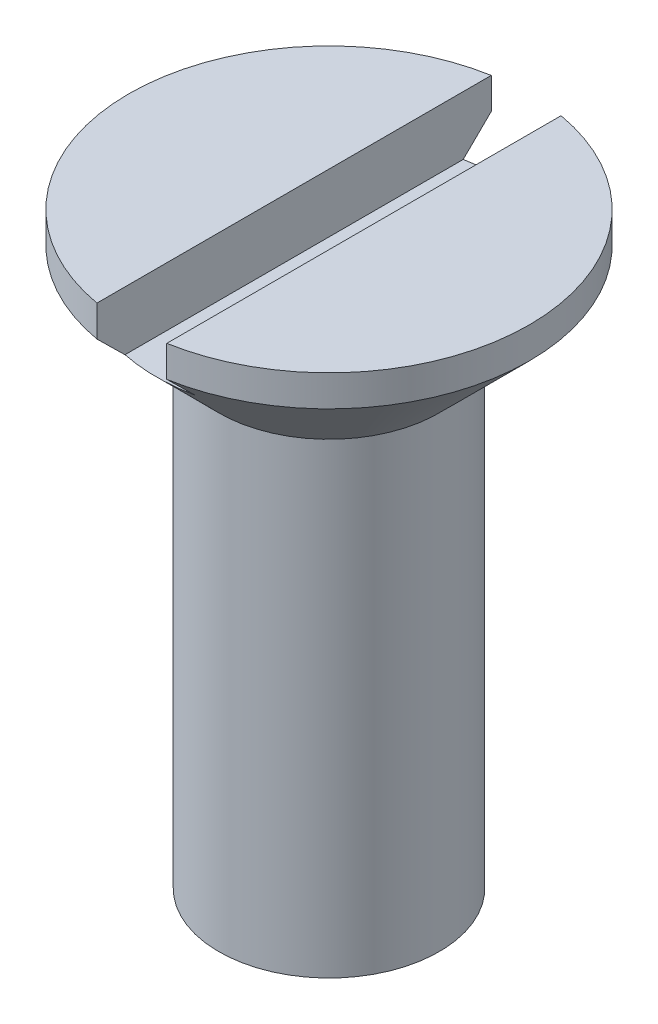
from build123d import *

# Parameters (mm, degrees)
CUT_EXTRUDE1_DEPTH      = 18.759645267
CUT_EXTRUDE1_DEPTH_BACK = 18.759645267
SKETCH2_W               = 1.9
SKETCH2_H               = 1.6


with BuildPart() as part:
    # Sketch1 → Revolve1 (revolve)
    with BuildSketch(Plane.XY):
        Polygon((0, 16), (-5.45, 16), (-5.45, 15.15), (-3, 12.7), (-3, 0), (0, -1.732050808), align=None)
    revolve(axis=Axis((0, 16, 0), (0, -1, 0)))

    # Sketch2 → Cut-Extrude1 (cut, two sides: drawn at the far end of the back side and taken through both)
    with BuildSketch(Plane.XY.offset(-CUT_EXTRUDE1_DEPTH_BACK)):
        with Locations((0, 15.2)):
            Rectangle(SKETCH2_W, SKETCH2_H)
    extrude(amount=CUT_EXTRUDE1_DEPTH + CUT_EXTRUDE1_DEPTH_BACK, mode=Mode.SUBTRACT)


solid = part.part
